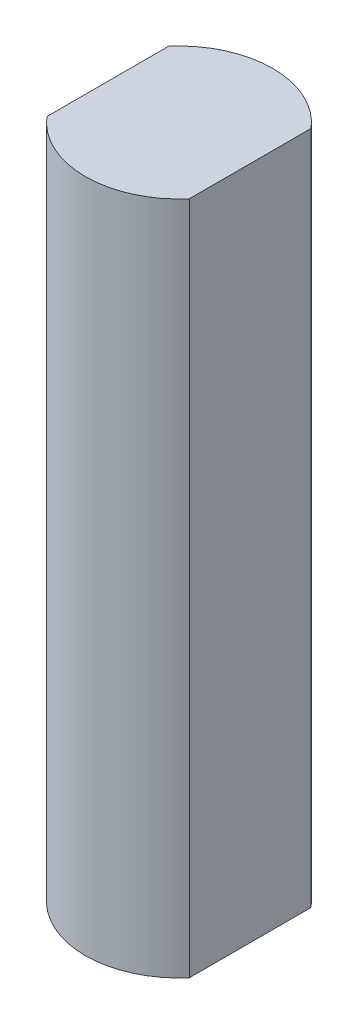
from build123d import *

# Parameters (mm, degrees)
BOSS_EXTRUDE1_DEPTH = 18


with BuildPart() as part:
    # Sketch1 → Boss-Extrude1 (new body)
    with BuildSketch(Plane(origin=(0, 0, 0), x_dir=(1, 0, 0), z_dir=(0, 1, 0))):
        with BuildLine():
            Line((1.9, -1.624807681), (1.9, 1.624807681))
            ThreePointArc((1.9, 1.624807681), (0, 2.5), (-1.9, 1.624807681))
            Line((-1.9, 1.624807681), (-1.9, -1.624807681))
            ThreePointArc((-1.9, -1.624807681), (0, -2.5), (1.9, -1.624807681))
        make_face()
    extrude(amount=BOSS_EXTRUDE1_DEPTH)


solid = part.part
